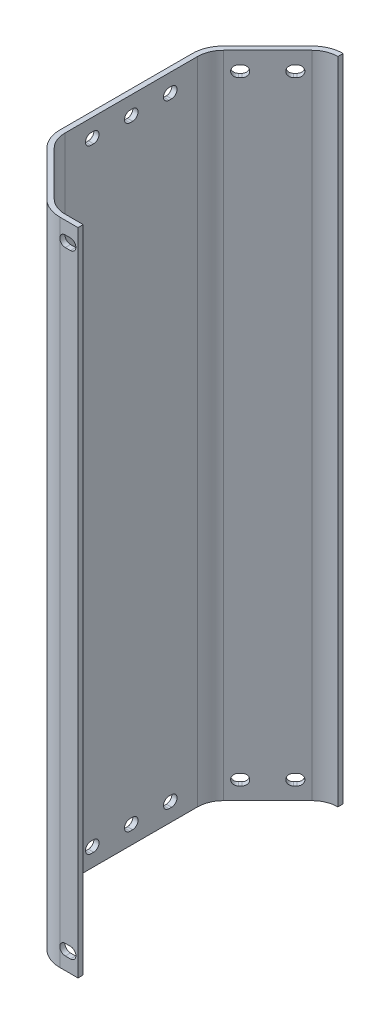
from build123d import *

# Parameters (mm, degrees)
EXTRUDE_1_DEPTH      = 250
CUT_EXTRUDE_2_DEPTH  = 250
CUT_EXTRUDE_4_DEPTH  = 250
CUT_EXTRUDE_5_DEPTH  = 250
CUT_EXTRUDE_6_DEPTH  = 250
SKETCH_12_W          = 2
SKETCH_12_H          = 250
CUT_EXTRUDE_11_DEPTH = 7


with BuildPart() as part:
    # 草图2 → 凸台-拉伸1 (new body)
    with BuildSketch(Plane(origin=(0, 0, 0), x_dir=(1, 0, 0), z_dir=(0, 1, 0))):
        with BuildLine():
            Line((-74.774044662, 52.864763338), (-74.774044662, 54.864763338))
            Line((-74.774044662, 54.864763338), (-81.774044662, 54.864763338))
            ThreePointArc((-81.774044662, 54.864763338), (-86.36624585, 53.951317728), (-90.259326036, 51.350044712))
            Line((-90.259326036, 51.350044712), (-107.255754699, 34.35361605))
            ThreePointArc((-107.255754699, 34.35361605), (-109.857027714, 30.460535864), (-110.770473324, 25.868334675))
            Line((-110.770473324, 25.868334675), (-110.770473324, -25.138808))
            ThreePointArc((-110.770473324, -25.138808), (-109.857027714, -29.731009188), (-107.255754699, -33.624089374))
            Line((-107.255754699, -33.624089374), (-90.259326036, -50.620518036))
            ThreePointArc((-90.259326036, -50.620518036), (-86.36624585, -53.221791052), (-81.774044662, -54.135236662))
            Line((-81.774044662, -54.135236662), (-74.774044662, -54.135236662))
            Line((-74.774044662, -54.135236662), (-74.774044662, -52.135236662))
            Line((-74.774044662, -52.135236662), (-81.774044662, -52.135236662))
            ThreePointArc((-81.774044662, -52.135236662), (-85.600878985, -51.374031987), (-88.845112474, -49.206304474))
            Line((-88.845112474, -49.206304474), (-105.841541136, -32.209875812))
            ThreePointArc((-105.841541136, -32.209875812), (-108.009268649, -28.965642323), (-108.770473324, -25.138808))
            Line((-108.770473324, -25.138808), (-108.770473324, 25.868334675))
            ThreePointArc((-108.770473324, 25.868334675), (-108.009268649, 29.695168999), (-105.841541136, 32.939402487))
            Line((-105.841541136, 32.939402487), (-88.845112474, 49.93583115))
            ThreePointArc((-88.845112474, 49.93583115), (-85.600878985, 52.103558663), (-81.774044662, 52.864763338))
            Line((-81.774044662, 52.864763338), (-74.774044662, 52.864763338))
        make_face()
    extrude(amount=EXTRUDE_1_DEPTH)

    # 草图3 → 切除-拉伸2 (cut)
    with BuildSketch(Plane(origin=(0, 0, -54.864763338), x_dir=(-1, 0, 0), z_dir=(0, 0, -1))):
        with BuildLine():
            ThreePointArc((79.674044662, 240.9), (81.774044662, 243), (79.674044662, 245.1))
            Line((79.674044662, 245.1), (77.674044662, 245.1))
            ThreePointArc((77.674044662, 245.1), (75.574044662, 243), (77.674044662, 240.9))
            Line((77.674044662, 240.9), (79.674044662, 240.9))
        make_face()
        with BuildLine():
            ThreePointArc((79.674044662, 9.1), (81.774044662, 7), (79.674044662, 4.9))
            Line((79.674044662, 4.9), (77.674044662, 4.9))
            ThreePointArc((77.674044662, 4.9), (75.574044662, 7), (77.674044662, 9.1))
            Line((77.674044662, 9.1), (79.674044662, 9.1))
        make_face()
    extrude(amount=-CUT_EXTRUDE_2_DEPTH, mode=Mode.SUBTRACT)

    # 草图4 → 切除-拉伸4 (cut)
    with BuildSketch(Plane(origin=(-70.804685374, 0, -70.804685374), x_dir=(-0.7071067811865558, 0, 0.7071067811865392), z_dir=(-0.7071067811865392, 0, -0.7071067811865558))):
        with BuildLine():
            Line((31.531306639, 9.1), (32.531306639, 9.1))
            ThreePointArc((32.531306639, 9.1), (34.631306639, 7), (32.531306639, 4.9))
            Line((32.531306639, 4.9), (31.531306639, 4.9))
            ThreePointArc((31.531306639, 4.9), (29.431306639, 7), (31.531306639, 9.1))
        make_face()
        with BuildLine():
            Line((47.531306639, 9.1), (46.531306639, 9.1))
            ThreePointArc((46.531306639, 9.1), (44.431306639, 7), (46.531306639, 4.9))
            Line((46.531306639, 4.9), (47.531306639, 4.9))
            ThreePointArc((47.531306639, 4.9), (49.631306639, 7), (47.531306639, 9.1))
        make_face()
        with BuildLine():
            Line((47.531306639, 240.9), (46.531306639, 240.9))
            ThreePointArc((46.531306639, 240.9), (44.431306639, 243), (46.531306639, 245.1))
            Line((46.531306639, 245.1), (47.531306639, 245.1))
            ThreePointArc((47.531306639, 245.1), (49.631306639, 243), (47.531306639, 240.9))
        make_face()
        with BuildLine():
            Line((31.531306639, 240.9), (32.531306639, 240.9))
            ThreePointArc((32.531306639, 240.9), (34.631306639, 243), (32.531306639, 245.1))
            Line((32.531306639, 245.1), (31.531306639, 245.1))
            ThreePointArc((31.531306639, 245.1), (29.431306639, 243), (31.531306639, 240.9))
        make_face()
    extrude(amount=-CUT_EXTRUDE_4_DEPTH, mode=Mode.SUBTRACT)

    # 草图5 → 切除-拉伸5 (cut)
    with BuildSketch(Plane(origin=(-70.439922036, 0, 70.439922036), x_dir=(0.7071067811865507, 0, 0.7071067811865445), z_dir=(-0.7071067811865445, 0, 0.7071067811865507))):
        with BuildLine():
            Line((-48.047159898, 9.1), (-47.047159898, 9.1))
            ThreePointArc((-47.047159898, 9.1), (-44.947159898, 7), (-47.047159898, 4.9))
            Line((-47.047159898, 4.9), (-48.047159898, 4.9))
            ThreePointArc((-48.047159898, 4.9), (-50.147159898, 7), (-48.047159898, 9.1))
        make_face()
        with BuildLine():
            Line((-32.047159898, 9.1), (-33.047159898, 9.1))
            ThreePointArc((-33.047159898, 9.1), (-35.147159898, 7), (-33.047159898, 4.9))
            Line((-33.047159898, 4.9), (-32.047159898, 4.9))
            ThreePointArc((-32.047159898, 4.9), (-29.947159898, 7), (-32.047159898, 9.1))
        make_face()
        with BuildLine():
            Line((-32.047159898, 240.9), (-33.047159898, 240.9))
            ThreePointArc((-33.047159898, 240.9), (-35.147159898, 243), (-33.047159898, 245.1))
            Line((-33.047159898, 245.1), (-32.047159898, 245.1))
            ThreePointArc((-32.047159898, 245.1), (-29.947159898, 243), (-32.047159898, 240.9))
        make_face()
        with BuildLine():
            Line((-48.047159898, 240.9), (-47.047159898, 240.9))
            ThreePointArc((-47.047159898, 240.9), (-44.947159898, 243), (-47.047159898, 245.1))
            Line((-47.047159898, 245.1), (-48.047159898, 245.1))
            ThreePointArc((-48.047159898, 245.1), (-50.147159898, 243), (-48.047159898, 240.9))
        make_face()
    extrude(amount=-CUT_EXTRUDE_5_DEPTH, mode=Mode.SUBTRACT)

    # 草图6 → 切除-拉伸6 (cut)
    with BuildSketch(Plane.ZY.offset(110.770473324)):
        with BuildLine():
            Line((-15.864763338, 9.1), (-14.864763338, 9.1))
            ThreePointArc((-14.864763338, 9.1), (-12.764763338, 7), (-14.864763338, 4.9))
            Line((-14.864763338, 4.9), (-15.864763338, 4.9))
            ThreePointArc((-15.864763338, 4.9), (-17.964763338, 7), (-15.864763338, 9.1))
        make_face()
        with BuildLine():
            Line((-0.864763338, 4.9), (0.135236662, 4.9))
            ThreePointArc((0.135236662, 4.9), (2.235236662, 7), (0.135236662, 9.1))
            Line((0.135236662, 9.1), (-0.864763338, 9.1))
            ThreePointArc((-0.864763338, 9.1), (-2.964763338, 7), (-0.864763338, 4.9))
        make_face()
        with BuildLine():
            Line((14.135236662, 4.9), (15.135236662, 4.9))
            ThreePointArc((15.135236662, 4.9), (17.235236662, 7), (15.135236662, 9.1))
            Line((15.135236662, 9.1), (14.135236662, 9.1))
            ThreePointArc((14.135236662, 9.1), (12.035236662, 7), (14.135236662, 4.9))
        make_face()
        with BuildLine():
            Line((14.135236662, 240.9), (15.135236662, 240.9))
            ThreePointArc((15.135236662, 240.9), (17.235236662, 243), (15.135236662, 245.1))
            Line((15.135236662, 245.1), (14.135236662, 245.1))
            ThreePointArc((14.135236662, 245.1), (12.035236662, 243), (14.135236662, 240.9))
        make_face()
        with BuildLine():
            Line((-0.864763338, 240.9), (0.135236662, 240.9))
            ThreePointArc((0.135236662, 240.9), (2.235236662, 243), (0.135236662, 245.1))
            Line((0.135236662, 245.1), (-0.864763338, 245.1))
            ThreePointArc((-0.864763338, 245.1), (-2.964763338, 243), (-0.864763338, 240.9))
        make_face()
        with BuildLine():
            Line((-15.864763338, 240.9), (-14.864763338, 240.9))
            ThreePointArc((-14.864763338, 240.9), (-12.764763338, 243), (-14.864763338, 245.1))
            Line((-14.864763338, 245.1), (-15.864763338, 245.1))
            ThreePointArc((-15.864763338, 245.1), (-17.964763338, 243), (-15.864763338, 240.9))
        make_face()
    extrude(amount=-CUT_EXTRUDE_6_DEPTH, mode=Mode.SUBTRACT)

    # 草图12 → 切除-拉伸11 (cut)
    with BuildSketch(Plane(origin=(-74.774044662, 0, 0), x_dir=(0, 0, -1), z_dir=(1, 0, 0))):
        with Locations((53.864763338, 125)):
            Rectangle(SKETCH_12_W, SKETCH_12_H)
    extrude(amount=-CUT_EXTRUDE_11_DEPTH, mode=Mode.SUBTRACT)


solid = part.part
